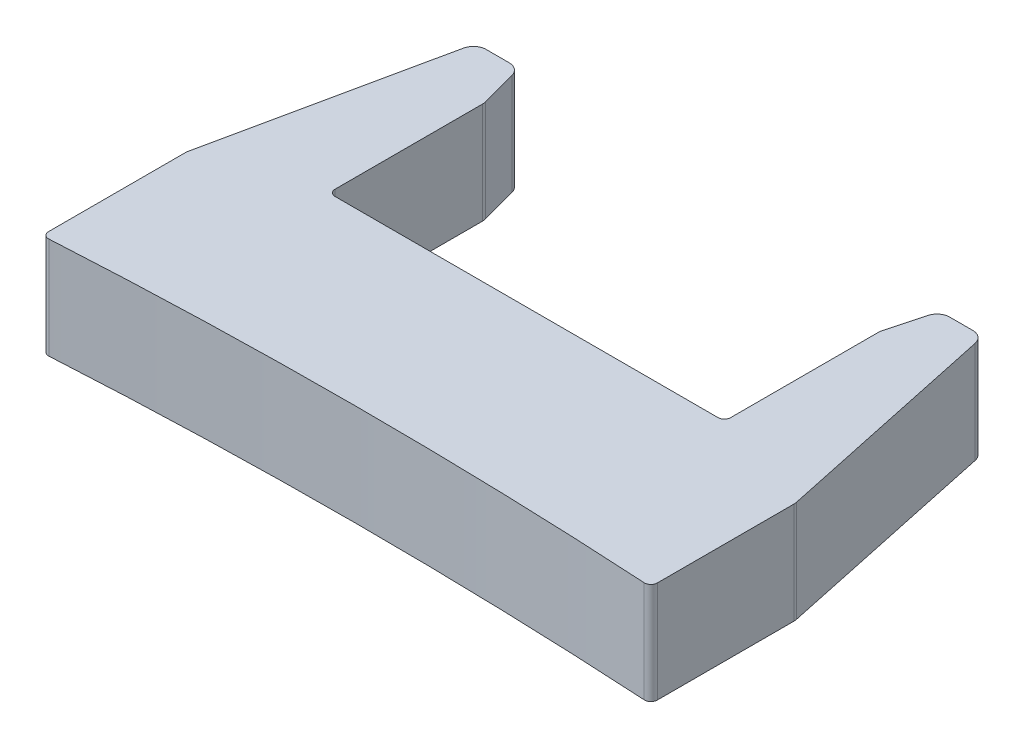
from build123d import *
from OCP.BRepFilletAPI import BRepFilletAPI_MakeChamfer

# Parameters (mm, degrees)
BOSS_EXTRUDE1_DEPTH       = 4
BOSS_EXTRUDE2_DEPTH       = 8
M6X1_0_TAPPED_HOLE1_D     = 5
M6X1_0_TAPPED_HOLE1_DEPTH = 11
M6X1_0_TAPPED_HOLE1_TIP   = 1.502151548
CHAMFER1_SIZE             = 1
CHAMFER1_SIZE2            = 3.732050808
FILLET1_R                 = 1
FILLET2_R                 = 0.5


with BuildPart() as part:
    # Sketch1 → Boss-Extrude1 (new, symmetric)
    with BuildSketch(Plane(origin=(0, 0, 0), x_dir=(1, 0, 0), z_dir=(0, 1, 0))):
        with BuildLine():
            Line((-20, 0), (0, 0))
            Line((0, 0), (20, 0))
            Line((20, 0), (20, -2.8))
            Line((20, -2.8), (24, -2.8))
            Line((24, -2.8), (24, -14.220649169))
            ThreePointArc((24, -14.220649169), (0, -13.5), (-24, -14.220649169))
            Line((-24, -14.220649169), (-24, -2.8))
            Line((-24, -2.8), (-20, -2.8))
            Line((-20, -2.8), (-20, 0))
        make_face()
    extrude(amount=BOSS_EXTRUDE1_DEPTH, both=True)

    # Sketch5 → Boss-Extrude2 (add)
    with BuildSketch(Plane(origin=(0, 4, 0), x_dir=(1, 0, 0), z_dir=(0, 1, 0))):
        Polygon((-20, 16), (-15.6, 16), (-15.6, 0), (-20, 0), (-20, -2.8), (-24, -2.8), align=None)
        Polygon((20, -2.8), (20, 0), (15.6, 0), (15.6, 16), (20, 16), (24, -2.8), align=None)
    extrude(amount=-BOSS_EXTRUDE2_DEPTH)

    # M6x1.0 Tapped Hole1
    with Locations(Plane(origin=(0, 0, 0), x_dir=(-1, 0, 0), z_dir=(0, 0, -1))):
        with Locations((0, 0)):
            Hole(M6X1_0_TAPPED_HOLE1_D / 2, depth=M6X1_0_TAPPED_HOLE1_DEPTH)
            with Locations((0, 0, -(M6X1_0_TAPPED_HOLE1_DEPTH + M6X1_0_TAPPED_HOLE1_TIP / 2))):  # 118° drill point
                Cone(0, M6X1_0_TAPPED_HOLE1_D / 2, M6X1_0_TAPPED_HOLE1_TIP, mode=Mode.SUBTRACT)

    # Chamfer1: one chamfer whose edges measure the first distance from different faces: ONE call of the kernel's chamfer builder (chamfer() names one face for all edges)
    chamfer1_edges_1 = [part.edges().sort_by_distance(p)[0] for p in [
        (-15.6, 0, -16),
    ]]
    chamfer1_side_1 = [part.faces().sort_by_distance(p)[0] for p in [
        (-17.8, 0, -16),
    ]]
    chamfer1_edges_2 = [part.edges().sort_by_distance(p)[0] for p in [
        (15.6, 0, -16),
    ]]
    chamfer1_side_2 = [part.faces().sort_by_distance(p)[0] for p in [
        (17.8, 0, -16),
    ]]
    chamfer1 = BRepFilletAPI_MakeChamfer(part.part.solid().wrapped)
    for e in chamfer1_edges_1:
        chamfer1.Add(CHAMFER1_SIZE, CHAMFER1_SIZE2, e.wrapped, chamfer1_side_1[0].wrapped)  # the first distance lies on this face
    for e in chamfer1_edges_2:
        chamfer1.Add(CHAMFER1_SIZE, CHAMFER1_SIZE2, e.wrapped, chamfer1_side_2[0].wrapped)  # the first distance lies on this face
    add(Compound.cast(chamfer1.Shape()), mode=Mode.REPLACE)

    # Fillet1
    fillet1_edges = [part.edges().sort_by_distance(p)[0] for p in [
        (24, 0, 2.8),
        (-24, 0, 2.8),
        (-20, 0, -16),
        (20, 0, -16),
        (16.6, 0, -16),
        (15.6, 0, -12.267949192),
        (-15.6, 0, -12.267949192),
        (-16.6, 0, -16),
    ]]
    fillet(fillet1_edges, radius=FILLET1_R)

    # Fillet2
    fillet2_edges = [part.edges().sort_by_distance(p)[0] for p in [
        (24, 0, 14.220649169),
        (-24, 0, 14.220649169),
        (-15.6, 0, 0),
        (15.6, 0, 0),
    ]]
    fillet(fillet2_edges, radius=FILLET2_R)


solid = part.part
